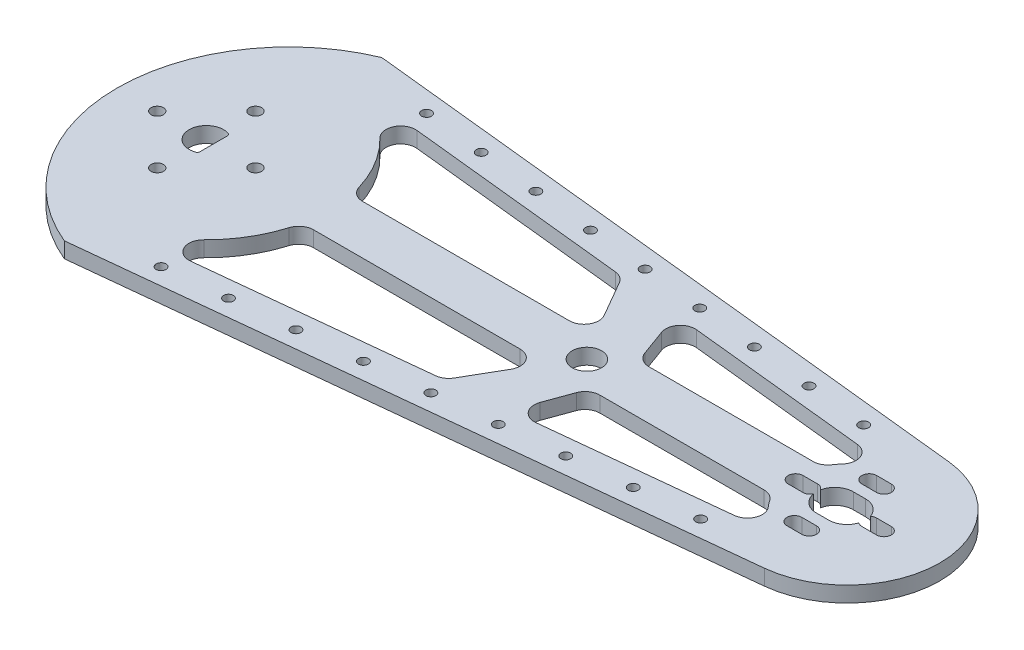
from build123d import *

# Parameters (mm, degrees)
BOSS_EXTRUDE1_DEPTH   = 6.35
CUT_EXTRUDE1_DEPTH    = 306.7995770016471
SKETCH3_R             = 7.500000000000012
CUT_EXTRUDE2_DEPTH    = 306.7242323837137
M6X1_0_TAPPED_HOLE1_D = 5
CUT_EXTRUDE4_DEPTH    = 10
SKETCH8_R             = 1.9999999999998708
SKETCH8_R_2           = 2.0000000000000036
SKETCH8_R_3           = 2.00000000000001
SKETCH8_R_4           = 1.9999999999999967
SKETCH8_R_5           = 2.0000000000000275
SKETCH8_R_6           = 1.9999999999999787
CUT_EXTRUDE5_DEPTH    = 10
SKETCH9_R             = 6.000000000000016
CUT_EXTRUDE6_DEPTH    = 10


with BuildPart() as part:
    # Sketch1 → Boss-Extrude1 (new body)
    with BuildSketch(Plane(origin=(0, 0, 0), x_dir=(1, 0, 0), z_dir=(0, 1, 0))):
        with BuildLine():
            Line((6.787858850574763, 64.64460512853856), (264.94156719392146, 37.537765655966744))
            ThreePointArc((264.94156719392146, 37.537765655966744), (298.7441359999997, 0), (264.94156719392146, -37.53776565596673))
            Line((264.94156719392146, -37.53776565596673), (6.787858850574784, -64.64460512853856))
            ThreePointArc((6.787858850574784, -64.64460512853856), (-65, 7.96e-15), (6.787858850574763, 64.64460512853856))
        make_face()
    extrude(amount=BOSS_EXTRUDE1_DEPTH)

    # Sketch2 → Cut-Extrude1 (cut, through all)
    with BuildSketch(Plane(origin=(0, 6.35, 0), x_dir=(1, 0, 0), z_dir=(0, 1, 0))):
        with BuildLine():
            Line((130.0180329989465, 36.62263756219651), (39.67304235209024, 46.10910659001378))
            ThreePointArc((39.67304235209024, 46.10910659001378), (33.61309581948125, 42.68718960147752), (34.86292032668156, 35.84099309862177))
            ThreePointArc((34.86292032668156, 35.84099309862177), (42.769548288999374, 25.89914552943688), (47.915742374995496, 14.285714285714283))
            ThreePointArc((47.915742374995496, 14.285714285714283), (50.07994563199178, 11.189297645576358), (53.665631459994955, 9.999999999999998))
            Line((53.665631459994955, 9.999999999999998), (137.8527855139708, 10.000000000000002))
            ThreePointArc((137.8527855139708, 10.000000000000002), (143.04893793667748, 13.000000000000009), (143.04893793667742, 19.000000000000078))
            Line((143.04893793667742, 19.000000000000078), (134.58761383544618, 33.65544324263917))
            ThreePointArc((134.58761383544618, 33.65544324263917), (132.65904297308322, 35.68763071395833), (130.0180329989465, 36.62263756219651))
        make_face()
        with BuildLine():
            Line((170.26578942302294, 10), (237.1206081654813, 10.000000000000002))
            ThreePointArc((237.1206081654813, 10.000000000000002), (239.94559756005083, 10.706661269050542), (242.10515009108008, 12.660188359810123))
            ThreePointArc((242.10515009108008, 12.660188359810123), (243.00987705511346, 13.915861411150573), (243.9979040786778, 15.107099545201987))
            ThreePointArc((243.9979040786778, 15.107099545201987), (245.10693815146783, 21.261347723744738), (240.1392503071075, 25.05961110306701))
            Line((240.1392503071075, 25.05961110306701), (166.9704585881833, 32.74253266268689))
            ThreePointArc((166.9704585881833, 32.74253266268689), (161.61563702112477, 30.46906980583447), (160.70573127726095, 24.723217483175404))
            Line((160.70573127726095, 24.723217483175404), (164.6276336983075, 13.94787914004592))
            ThreePointArc((164.6276336983075, 13.94787914004592), (166.82433080491668, 11.085087734266024), (170.26578942302294, 10))
        make_face()
        with BuildLine():
            Line((170.26578942302294, -10), (237.1206081654813, -10.000000000000002))
            ThreePointArc((237.1206081654813, -10.000000000000002), (239.94559756005083, -10.706661269050542), (242.10515009108008, -12.660188359810123))
            ThreePointArc((242.10515009108008, -12.660188359810123), (243.00987705511346, -13.915861411150573), (243.9979040786778, -15.107099545201987))
            ThreePointArc((243.9979040786778, -15.107099545201987), (245.10693815146783, -21.261347723744738), (240.1392503071075, -25.05961110306701))
            Line((240.1392503071075, -25.05961110306701), (166.9704585881833, -32.74253266268689))
            ThreePointArc((166.9704585881833, -32.74253266268689), (161.61563702112477, -30.46906980583447), (160.70573127726095, -24.723217483175404))
            Line((160.70573127726095, -24.723217483175404), (164.6276336983075, -13.94787914004592))
            ThreePointArc((164.6276336983075, -13.94787914004592), (166.82433080491668, -11.085087734266024), (170.26578942302294, -10))
        make_face()
        with BuildLine():
            Line((130.01803299894652, -36.622637562196495), (39.67304235209024, -46.10910659001378))
            ThreePointArc((39.67304235209024, -46.10910659001378), (33.61309581948125, -42.68718960147752), (34.86292032668156, -35.84099309862177))
            ThreePointArc((34.86292032668156, -35.84099309862177), (42.769548288999374, -25.89914552943688), (47.915742374995496, -14.285714285714283))
            ThreePointArc((47.915742374995496, -14.285714285714283), (50.07994563199178, -11.189297645576358), (53.665631459994955, -9.999999999999998))
            Line((53.665631459994955, -9.999999999999998), (137.8527855139708, -10))
            ThreePointArc((137.8527855139708, -10), (143.04893793667745, -13.000000000000027), (143.0489379366774, -19.000000000000057))
            Line((143.0489379366774, -19.000000000000057), (134.58761383544623, -33.65544324263918))
            ThreePointArc((134.58761383544623, -33.65544324263918), (132.65904297308327, -35.687630713958356), (130.01803299894652, -36.622637562196495))
        make_face()
        with BuildLine():
            ThreePointArc((6.787858850574784, -64.64460512853856), (-36.35930093139005, 2.251e-14), (6.787858850574836, 64.64460512853859))
            ThreePointArc((6.787858850574836, 64.64460512853859), (-65.00000000000003, 3.683e-14), (6.787858850574784, -64.64460512853856))
        make_face()
    extrude(amount=-CUT_EXTRUDE1_DEPTH, mode=Mode.SUBTRACT)

    # Sketch3 → Cut-Extrude2 (cut, through all)
    with BuildSketch(Plane(origin=(0, 6.35, 0), x_dir=(1, 0, 0), z_dir=(0, 1, 0))):
        with Locations(Location((261, 0, 0), (0, 0, 270))):
            Circle(SKETCH3_R)
        with BuildLine():
            Line((3.0000000000000004, 5.65685424949238), (3.0000000000000004, -5.65685424949238))
            ThreePointArc((3.0000000000000004, -5.65685424949238), (2.8164965809277267, -6.234204518682005), (2.333333333333334, -6.599663291074442))
            ThreePointArc((2.333333333333334, -6.599663291074442), (-6.999999999999999, 8.6e-16), (2.333333333333334, 6.599663291074442))
            ThreePointArc((2.333333333333334, 6.599663291074442), (2.8164965809277267, 6.234204518682005), (3.0000000000000004, 5.65685424949238))
        make_face()
    extrude(amount=-CUT_EXTRUDE2_DEPTH, mode=Mode.SUBTRACT)

    # M6x1.0 Tapped Hole1 (through all)
    with Locations(Plane(origin=(0, 6.35, 0), x_dir=(1, 0, 0), z_dir=(0, 1, 0))):
        with Locations((0, 20), (20, 0), (0, -20), (-20, 0), (276, 0), (246.00004616, 0.037212923), (246, 0), (260.510261233, 14.992003066), (260.510261233, -14.992003066)):
            Hole(M6X1_0_TAPPED_HOLE1_D / 2)

    # Sketch7 → Cut-Extrude4 (cut)
    with BuildSketch(Plane(origin=(0, 6.35, 0), x_dir=(1, 0, 0), z_dir=(0, 1, 0))):
        with BuildLine():
            Line((261.0000005017777, -7.5), (256, -7.5))
            ThreePointArc((256, -7.5), (251.2288142968451, -5.786690503734399), (248.63750000000002, -1.42954319626934))
            ThreePointArc((248.63750000000002, -1.42954319626934), (247.53482452006037, -2.577656628145443), (246.00000083547474, -3.0000000000000013))
            Line((246.00000083547474, -3.0000000000000013), (240, -3.000000000000001))
            ThreePointArc((240, -3.000000000000001), (236.99999999999991, -4.1773736761e-07), (239.99999916452526, 3.0000000000000004))
            Line((239.99999916452526, 3.0000000000000004), (246, 3))
            ThreePointArc((246, 3), (247.53482416113246, 2.577656841863176), (248.63750000000002, 1.42954319626934))
            ThreePointArc((248.63750000000002, 1.42954319626934), (251.2288141032696, 5.786690344129463), (255.99999949822234, 7.5))
            Line((255.99999949822234, 7.5), (261, 7.5))
            ThreePointArc((261, 7.5), (265.39806452485095, 6.07511550797577), (268.125, 2.341874249399391))
            ThreePointArc((268.125, 2.341874249399391), (269.0064263359464, 2.830690971140985), (270, 3))
            Line((270, 3), (276, 3))
            ThreePointArc((276, 3), (279, 0), (276, -3))
            Line((276, -3), (270, -3))
            ThreePointArc((270, -3), (269.0064263359464, -2.8306909711409793), (268.125, -2.341874249399391))
            ThreePointArc((268.125, -2.341874249399391), (265.39806472807476, -6.075115360852396), (261.0000005017777, -7.5))
        make_face()
        with BuildLine():
            Line((260.51026123316717, -17.992003066310435), (254.51026123316717, -17.99200306631043))
            ThreePointArc((254.51026123316717, -17.99200306631043), (251.51026123316717, -14.992003066310435), (254.51026123316717, -11.992003066310438))
            Line((254.51026123316717, -11.992003066310438), (260.51026123316717, -11.992003066310433))
            ThreePointArc((260.51026123316717, -11.992003066310433), (263.51026123316717, -14.992003066310435), (260.51026123316717, -17.992003066310435))
        make_face()
        with BuildLine():
            Line((261, 12.000000000000014), (255, 12.00000000000001))
            ThreePointArc((255, 12.00000000000001), (252, 15.000000000000012), (255, 18.000000000000014))
            Line((255, 18.000000000000014), (261, 18.000000000000014))
            ThreePointArc((261, 18.000000000000014), (264, 15.000000000000014), (261, 12.000000000000014))
        make_face()
    extrude(amount=-CUT_EXTRUDE4_DEPTH, mode=Mode.SUBTRACT)

    # Sketch8 → Cut-Extrude5 (cut)
    with BuildSketch(Plane(origin=(0, 6.35, 0), x_dir=(1, 0, 0), z_dir=(0, 1, 0))):
        with Locations(Location((35.6282598801996, -54.07505226292096, 0), (0, 0, 270))):
            Circle(SKETCH8_R)
        with Locations(Location((60.49156954502199, -51.46433732039219, 0), (0, 0, 270))):
            Circle(SKETCH8_R_2)
        with Locations(Location((85.35487920984451, -48.853622377863424, 0), (0, 0, 270))):
            Circle(SKETCH8_R_3)
        with Locations(Location((110.21818887466702, -46.24290743533465, 0), (0, 0, 270))):
            Circle(SKETCH8_R_4)
        with Locations(Location((135.08149853948953, -43.63219249280589, 0), (0, 0, 270))):
            Circle(SKETCH8_R_5)
        with Locations(Location((159.9448082043121, -41.02147755027711, 0), (0, 0, 270))):
            Circle(SKETCH8_R_4)
        with Locations(Location((184.8081178691346, -38.41076260774834, 0), (0, 0, 270))):
            Circle(SKETCH8_R_4)
        with Locations(Location((209.67142753395711, -35.80004766521956, 0), (0, 0, 270))):
            Circle(SKETCH8_R_4)
        with Locations(Location((234.53473719877965, -33.1893327226908, 0), (0, 0, 270))):
            Circle(SKETCH8_R_4)
        with Locations(Location((234.53473719877965, 33.1893327226908, 0), (0, 0, 270))):
            Circle(SKETCH8_R_4)
        with Locations(Location((209.67142753395711, 35.80004766521956, 0), (0, 0, 270))):
            Circle(SKETCH8_R_4)
        with Locations(Location((184.8081178691346, 38.41076260774834, 0), (0, 0, 270))):
            Circle(SKETCH8_R_4)
        with Locations(Location((159.9448082043121, 41.02147755027711, 0), (0, 0, 270))):
            Circle(SKETCH8_R_4)
        with Locations(Location((135.08149853948953, 43.63219249280589, 0), (0, 0, 270))):
            Circle(SKETCH8_R_5)
        with Locations(Location((110.21818887466702, 46.24290743533465, 0), (0, 0, 270))):
            Circle(SKETCH8_R_4)
        with Locations(Location((85.35487920984451, 48.853622377863424, 0), (0, 0, 270))):
            Circle(SKETCH8_R_3)
        with Locations(Location((60.49156954502199, 51.46433732039219, 0), (0, 0, 270))):
            Circle(SKETCH8_R_2)
        with Locations(Location((35.628259880199494, 54.07505226292097, 0), (0, 0, 270))):
            Circle(SKETCH8_R_6)
    extrude(amount=-CUT_EXTRUDE5_DEPTH, mode=Mode.SUBTRACT)

    # Sketch9 → Cut-Extrude6 (cut)
    with BuildSketch(Plane(origin=(0, 6.35, 0), x_dir=(1, 0, 0), z_dir=(0, 1, 0))):
        with Locations(Location((155, 0, 0), (0, 0, 270))):
            Circle(SKETCH9_R)
    extrude(amount=-CUT_EXTRUDE6_DEPTH, mode=Mode.SUBTRACT)


solid = part.part
